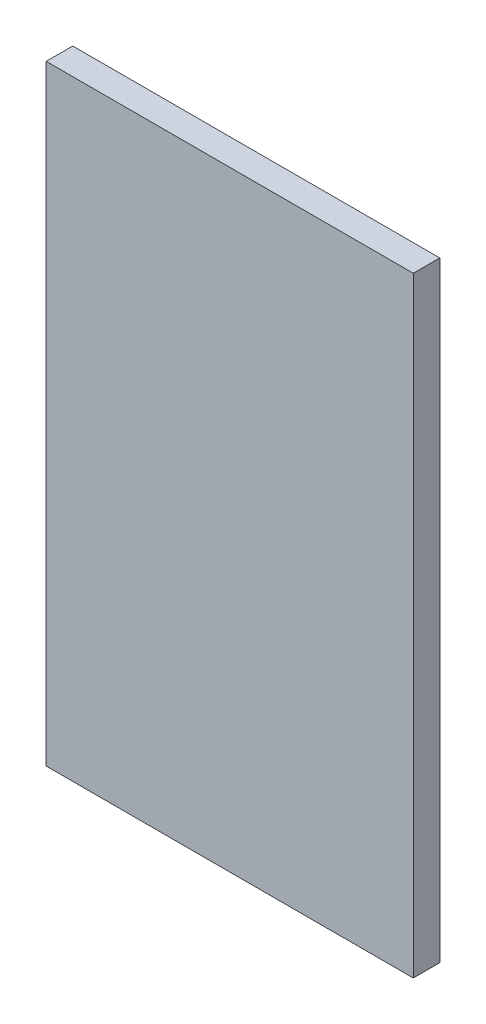
from build123d import *

# Parameters (mm, degrees)
SKETCH3_W           = 166
SKETCH3_H           = 276
BOSS_EXTRUDE2_DEPTH = 12


with BuildPart() as part:
    # Sketch3 → Boss-Extrude2 (new body)
    with BuildSketch(Plane.XY):
        with Locations((500, 68)):
            Rectangle(SKETCH3_W, SKETCH3_H)
    extrude(amount=BOSS_EXTRUDE2_DEPTH)


solid = part.part
